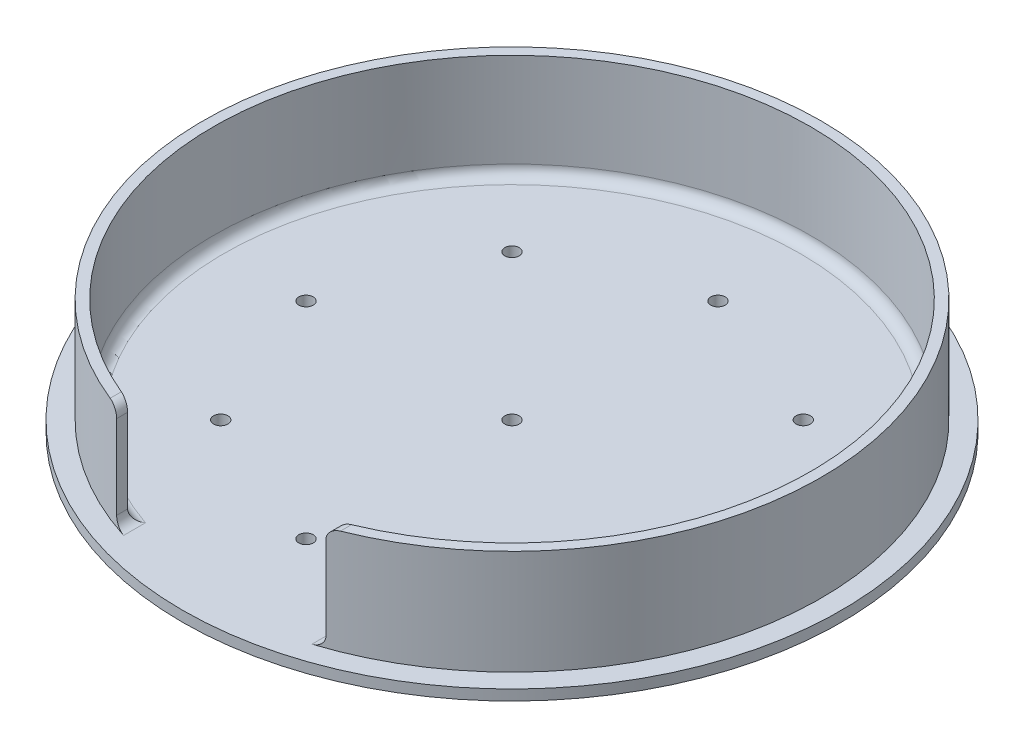
from build123d import *

# Parameters (mm, degrees)
SKETCH1_R           = 80
BOSS_EXTRUDE1_DEPTH = 2.54
SKETCH2_R           = 75
SKETCH2_R_2         = 72.5
BOSS_EXTRUDE2_DEPTH = 25.4
SKETCH3_R           = 1.75
CUT_EXTRUDE1_DEPTH  = 116.953266448
SKETCH4_W           = 50.8
SKETCH4_H           = 25.4
CUT_EXTRUDE2_DEPTH  = 25.4
FILLET1_R           = 2.54


with BuildPart() as part:
    # Sketch1 → Boss-Extrude1 (new body)
    with BuildSketch(Plane(origin=(0, 0, 0), x_dir=(1, 0, 0), z_dir=(0, 1, 0))):
        with Locations(Location((0, 0, 0), (0, 0, 270))):
            Circle(SKETCH1_R)
    extrude(amount=BOSS_EXTRUDE1_DEPTH)

    # Sketch2 → Boss-Extrude2 (add)
    with BuildSketch(Plane(origin=(0, 2.54, 0), x_dir=(1, 0, 0), z_dir=(0, 1, 0))):
        with Locations(Location((0, 0, 0), (0, 0, 270))):
            Circle(SKETCH2_R)
        with Locations(Location((0, 0, 0), (0, 0, 270))):
            Circle(SKETCH2_R_2, mode=Mode.SUBTRACT)
    extrude(amount=BOSS_EXTRUDE2_DEPTH)

    # Sketch3 → Cut-Extrude1 (cut, through all)
    with BuildSketch(Plane(origin=(0, 2.54, 0), x_dir=(1, 0, 0), z_dir=(0, 1, 0))):
        with Locations(Location((0, 50, 0), (0, 0, 270))):
            Circle(SKETCH3_R)
        with Locations(Location((50, 0, 0), (0, 0, 270))):
            Circle(SKETCH3_R)
        with Locations(Location((0, -50, 0), (0, 0, 270))):
            Circle(SKETCH3_R)
        with Locations(Location((-50, 0, 0), (0, 0, 270))):
            Circle(SKETCH3_R)
        with Locations(Location((35.355339059, 35.355339059, 0), (0, 0, 270))):
            Circle(SKETCH3_R)
        with Locations(Location((35.355339059, -35.355339059, 0), (0, 0, 270))):
            Circle(SKETCH3_R)
        with Locations(Location((-35.355339059, -35.355339059, 0), (0, 0, 270))):
            Circle(SKETCH3_R)
        with Locations(Location((-35.355339059, 35.355339059, 0), (0, 0, 270))):
            Circle(SKETCH3_R)
        with Locations(Location((0, 0, 0), (0, 0, 270))):
            Circle(SKETCH3_R)
    extrude(amount=-CUT_EXTRUDE1_DEPTH, mode=Mode.SUBTRACT)

    # Sketch4 → Cut-Extrude2 (cut)
    with BuildSketch(Plane(origin=(0, 27.94, 0), x_dir=(1, 0, 0), z_dir=(0, 1, 0))):
        with Locations((0, -75)):
            Rectangle(SKETCH4_W, SKETCH4_H)
    extrude(amount=-CUT_EXTRUDE2_DEPTH, mode=Mode.SUBTRACT)

    # Fillet1
    fillet1_edges = [part.edges().sort_by_distance(p)[0] for p in [
        (0, 2.54, -72.5),
        (-25.4, 27.94, 69.236494294),
        (25.4, 27.94, 69.236494294),
        (-25.4, 2.54, 69.236494294),
        (25.4, 2.54, 69.236494294),
    ]]
    fillet(fillet1_edges, radius=FILLET1_R)


solid = part.part
